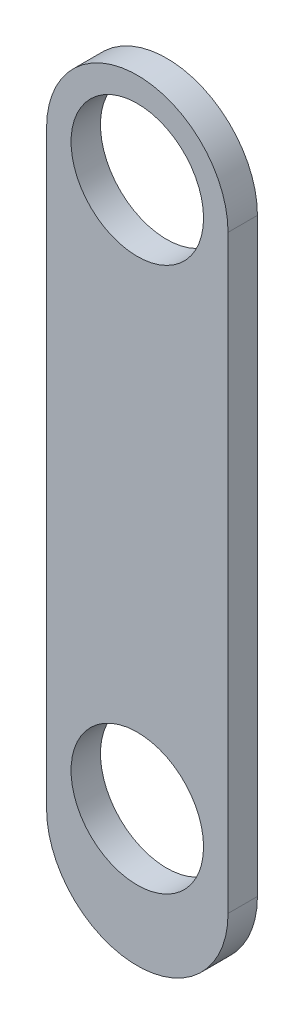
from build123d import *

# Parameters (mm, degrees)
SKETCH1_R           = 9.271
BOSS_EXTRUDE1_DEPTH = 4.1148


with BuildPart() as part:
    # Sketch1 → Boss-Extrude1 (new body)
    with BuildSketch(Plane.XY):
        with BuildLine():
            Line((0, 0), (0, 82.55))
            ThreePointArc((0, 82.55), (12.7, 95.25), (25.4, 82.55))
            Line((25.4, 82.55), (25.4, 0))
            ThreePointArc((25.4, 0), (12.7, -12.7), (0, 0))
        make_face()
        with Locations((12.7, 82.55)):
            Circle(SKETCH1_R, mode=Mode.SUBTRACT)
        with Locations((12.7, 6.35)):
            Circle(SKETCH1_R, mode=Mode.SUBTRACT)
    extrude(amount=BOSS_EXTRUDE1_DEPTH)


solid = part.part
